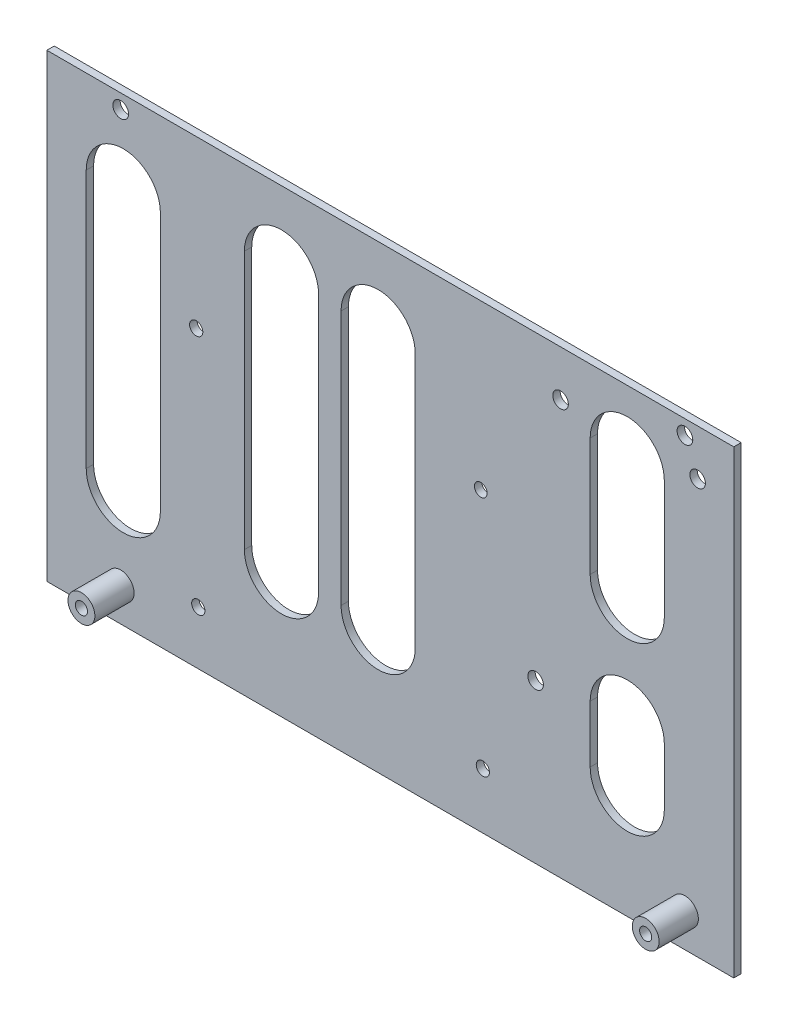
from build123d import *

# Parameters (mm, degrees)
SKETCH1_W           = 140
SKETCH1_H           = 93.753760253
BOSS_EXTRUDE1_DEPTH = 1.5
SKETCH2_R           = 1.6
CUT_EXTRUDE1_DEPTH  = 1.5
SKETCH3_R           = 2.737611944
SKETCH3_R_2         = 1.237611944
BOSS_EXTRUDE2_DEPTH = 8
SKETCH4_R           = 1.3
SKETCH4_R_2         = 1.35
SKETCH4_R_3         = 1.5875
CUT_EXTRUDE2_DEPTH  = 8
CUT_EXTRUDE3_DEPTH  = 10


with BuildPart() as part:
    # Sketch1 → Boss-Extrude1 (new body)
    with BuildSketch(Plane.XY):
        with Locations((102, 196.095777869)):
            Rectangle(SKETCH1_W, SKETCH1_H)
    extrude(amount=BOSS_EXTRUDE1_DEPTH)

    # Sketch2 → Cut-Extrude1 (cut)
    with BuildSketch(Plane.XY.offset(1.5)):
        with Locations((47.04400772, 240.027868216)):
            Circle(SKETCH2_R)
        with Locations((162.04400772, 240.027868216)):
            Circle(SKETCH2_R)
    extrude(amount=-CUT_EXTRUDE1_DEPTH, mode=Mode.SUBTRACT)

    # Sketch3 → Boss-Extrude2 (add)
    # profile 1 of 2: a face of its own
    with BuildSketch(Plane.XY.offset(1.5)):
        with Locations((47.04400772, 156.027868216)):
            Circle(SKETCH3_R)
        with Locations((47.04400772, 156.027868216)):
            Circle(SKETCH3_R_2, mode=Mode.SUBTRACT)
    # profile 2 of 2: a face of its own
    with BuildSketch(Plane.XY.offset(1.5)):
        with Locations((162.04400772, 156.027868216)):
            Circle(SKETCH3_R)
        with Locations((162.04400772, 156.027868216)):
            Circle(SKETCH3_R_2, mode=Mode.SUBTRACT)
    extrude(amount=BOSS_EXTRUDE2_DEPTH)

    # Sketch4 → Cut-Extrude2 (cut)
    with BuildSketch(Plane(origin=(0, 0, 0), x_dir=(-1, 0, 0), z_dir=(0, 0, -1))):
        with Locations((-120.431826709, 209.617216317)):
            Circle(SKETCH4_R)
        with Locations((-62.434035172, 209.111077258)):
            Circle(SKETCH4_R_2)
        with Locations((-62.861635411, 160.112943028)):
            Circle(SKETCH4_R_2)
        with Locations((-120.859426949, 160.619082087)):
            Circle(SKETCH4_R_2)
        with Locations((-131.613133958, 181.551872542)):
            Circle(SKETCH4_R_3)
        with Locations((-136.693133958, 233.621872542)):
            Circle(SKETCH4_R_3)
        with Locations((-164.633133958, 233.621872542)):
            Circle(SKETCH4_R_3)
    extrude(amount=-CUT_EXTRUDE2_DEPTH, mode=Mode.SUBTRACT)

    # Sketch5 → Cut-Extrude3 (cut)
    with BuildSketch(Plane.XY.offset(1.5)):
        with BuildLine():
            Line((87.370025241, 227.627019548), (87.370025241, 174.953532483))
            ThreePointArc((87.370025241, 174.953532483), (79.813693114, 167.397200355), (72.257360986, 174.953532483))
            Line((72.257360986, 174.953532483), (72.257360986, 227.627019548))
            ThreePointArc((72.257360986, 227.627019548), (79.813693114, 235.183351676), (87.370025241, 227.627019548))
        make_face()
        with BuildLine():
            Line((107.076686064, 226.935622361), (107.076686064, 174.953532483))
            ThreePointArc((107.076686064, 174.953532483), (99.520353936, 167.397200355), (91.964021808, 174.953532483))
            Line((91.964021808, 174.953532483), (91.964021808, 226.935622361))
            ThreePointArc((91.964021808, 226.935622361), (99.520353936, 234.491954489), (107.076686064, 226.935622361))
        make_face()
        with BuildLine():
            Line((142.731512272, 205.818600592), (142.731512272, 229.897268949))
            ThreePointArc((142.731512272, 229.897268949), (150.2878444, 237.453601077), (157.844176528, 229.897268949))
            Line((157.844176528, 229.897268949), (157.844176528, 205.818600592))
            ThreePointArc((157.844176528, 205.818600592), (150.2878444, 198.262268464), (142.731512272, 205.818600592))
        make_face()
        with BuildLine():
            Line((157.844176528, 183.436532175), (157.844176528, 171.821347981))
            ThreePointArc((157.844176528, 171.821347981), (150.2878444, 164.265015853), (142.731512272, 171.821347981))
            Line((142.731512272, 171.821347981), (142.731512272, 183.436532175))
            ThreePointArc((142.731512272, 183.436532175), (150.2878444, 190.992864302), (157.844176528, 183.436532175))
        make_face()
        with BuildLine():
            Line((55.134626412, 225.825721278), (55.134626412, 173.152234213))
            ThreePointArc((55.134626412, 173.152234213), (47.578294284, 165.595902085), (40.021962156, 173.152234213))
            Line((40.021962156, 173.152234213), (40.021962156, 225.825721278))
            ThreePointArc((40.021962156, 225.825721278), (47.578294284, 233.382053406), (55.134626412, 225.825721278))
        make_face()
    extrude(amount=-CUT_EXTRUDE3_DEPTH, mode=Mode.SUBTRACT)


solid = part.part
